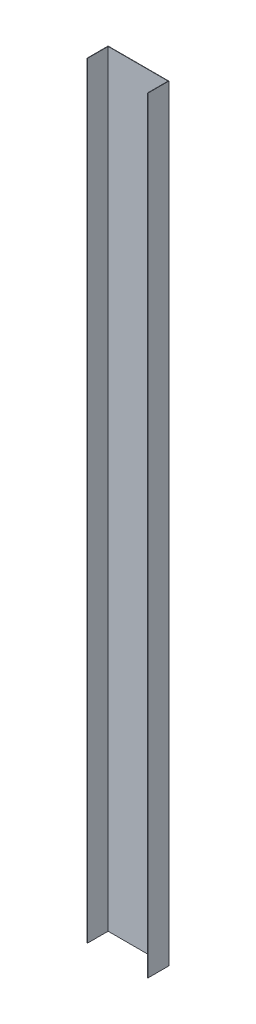
from build123d import *

# Parameters (mm, degrees)
BOSS_EXTRUDE1_DEPTH = 1162.05


with BuildPart() as part:
    # Sketch1 → Boss-Extrude1 (new body)
    with BuildSketch(Plane(origin=(0, 0, 0), x_dir=(1, 0, 0), z_dir=(0, 1, 0))):
        Polygon((0, 0), (0, 31.219), (91.013, 31.219), (91.013, 0), (91.544, 0), (91.544, 31.75), (-0.531, 31.75), (-0.531, 0), align=None)
    extrude(amount=BOSS_EXTRUDE1_DEPTH)


solid = part.part
